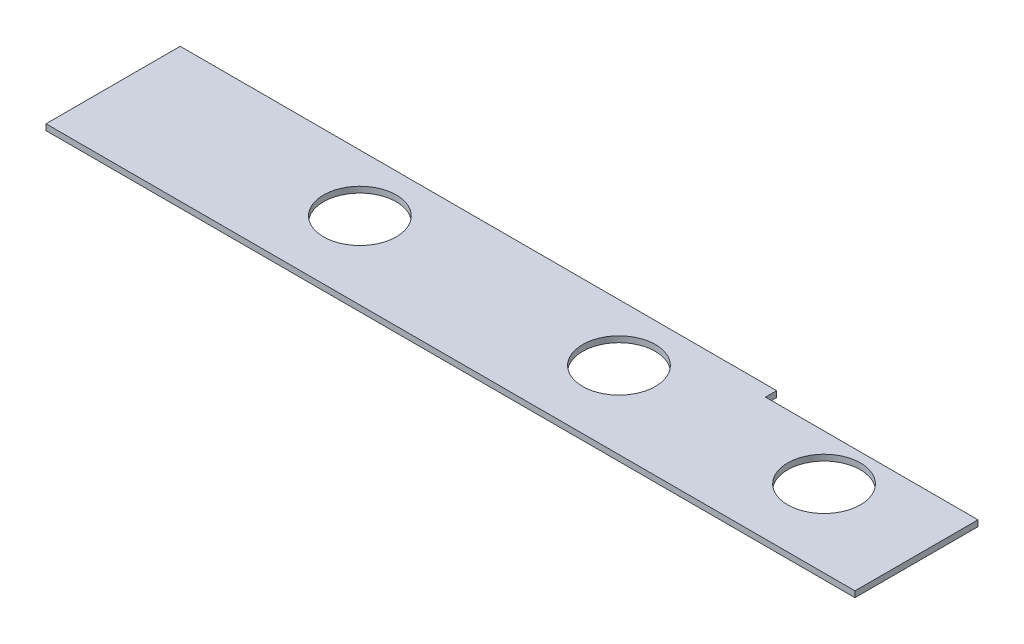
from build123d import *

# Parameters (mm, degrees)
SKETCH2_R           = 9.75
BOSS_EXTRUDE1_DEPTH = 1.6


with BuildPart() as part:
    # Sketch2 → Boss-Extrude1 (new body)
    with BuildSketch(Plane(origin=(0, 0, 0), x_dir=(1, 0, 0), z_dir=(0, 1, 0))):
        Polygon((-108.5, 18), (51.5, 18), (51.5, 15), (108.5, 15), (108.5, -18), (-108.5, -18), align=None)
        with Locations(Location((-45, 2.7, 0), (0, 0, 270))):
            Circle(SKETCH2_R, mode=Mode.SUBTRACT)
        with Locations(Location((24.5, 2.7, 0), (0, 0, 270))):
            Circle(SKETCH2_R, mode=Mode.SUBTRACT)
        with Locations(Location((79.5, 2.7, 0), (0, 0, 270))):
            Circle(SKETCH2_R, mode=Mode.SUBTRACT)
    extrude(amount=BOSS_EXTRUDE1_DEPTH)


solid = part.part
